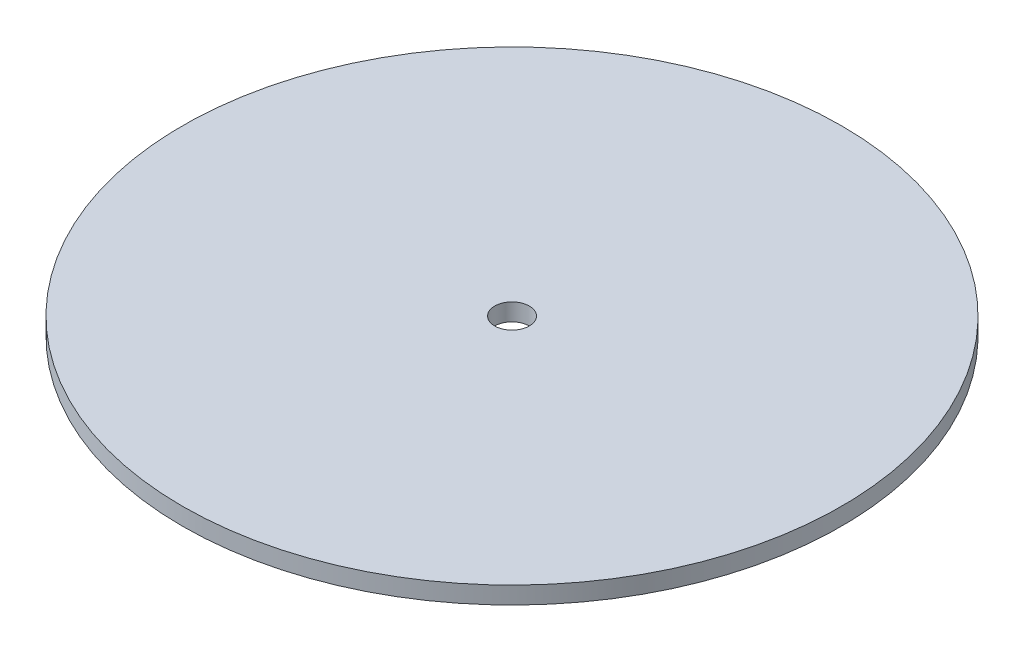
from build123d import *

# Parameters (mm, degrees)
SKETCH1_R           = 76.2
SKETCH1_R_2         = 4
BOSS_EXTRUDE1_DEPTH = 4


with BuildPart() as part:
    # Sketch1 → Boss-Extrude1 (new body)
    with BuildSketch(Plane(origin=(0, 0, 0), x_dir=(1, 0, 0), z_dir=(0, 1, 0))):
        with Locations(Location((0, 0, 0), (0, 0, 270))):
            Circle(SKETCH1_R)
        with Locations(Location((0, 0, 0), (0, 0, 270))):
            Circle(SKETCH1_R_2, mode=Mode.SUBTRACT)
    extrude(amount=BOSS_EXTRUDE1_DEPTH)


solid = part.part
